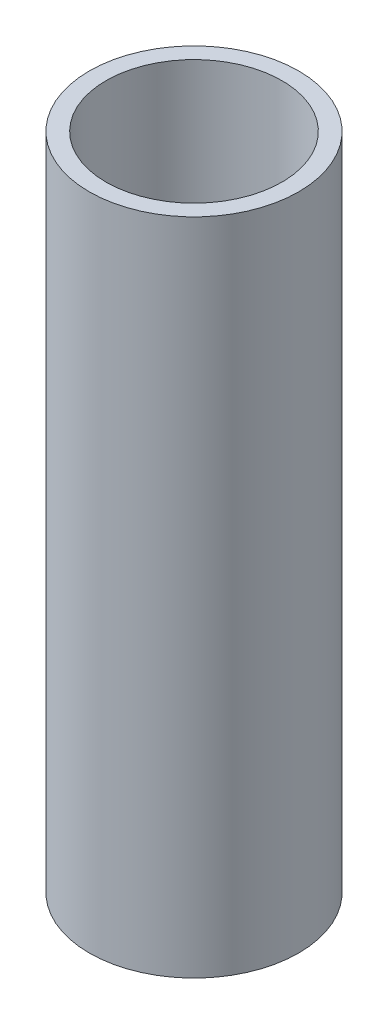
from build123d import *

# Parameters (mm, degrees)
SKETCH_1_R      = 3.175
SKETCH_1_R_2    = 2.667
EXTRUDE_1_DEPTH = 19.9898


with BuildPart() as part:
    # 草图1 → 凸台-拉伸1 (new body)
    with BuildSketch(Plane(origin=(0, 0, 0), x_dir=(1, 0, 0), z_dir=(0, 1, 0))):
        with Locations(Location((0, 0, 0), (0, 0, 270))):
            Circle(SKETCH_1_R)
        with Locations(Location((0, 0, 0), (0, 0, 270))):
            Circle(SKETCH_1_R_2, mode=Mode.SUBTRACT)
    extrude(amount=EXTRUDE_1_DEPTH)


solid = part.part
